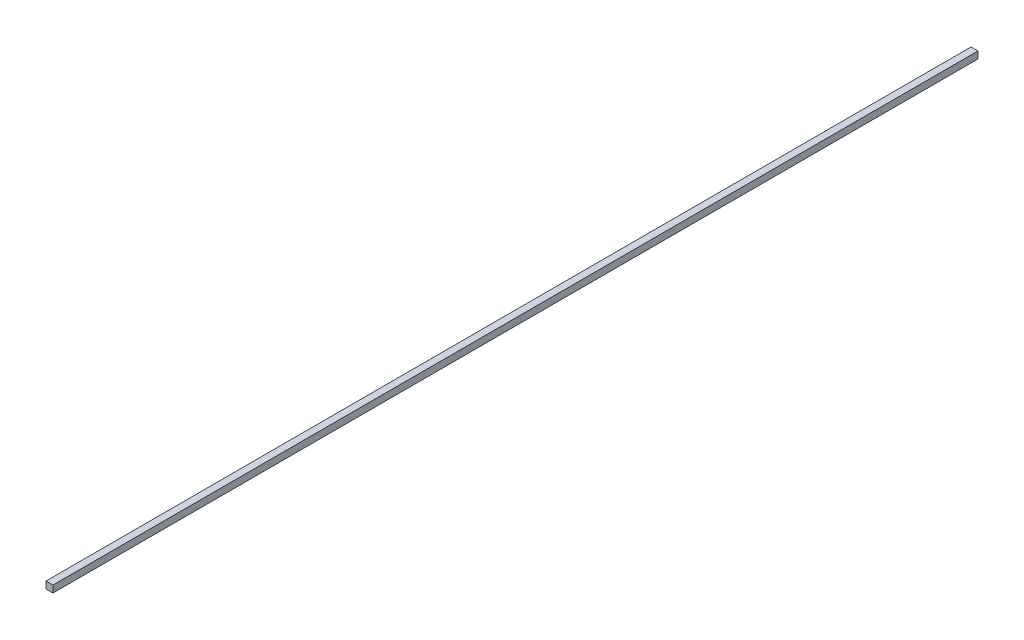
from build123d import *

# Parameters (mm, degrees)
SKETCH1_W           = 15
SKETCH1_H           = 15
BOSS_EXTRUDE1_DEPTH = 2000


with BuildPart() as part:
    # Sketch1 → Boss-Extrude1 (new body)
    with BuildSketch(Plane.XY):
        Rectangle(SKETCH1_W, SKETCH1_H)
    extrude(amount=BOSS_EXTRUDE1_DEPTH)


solid = part.part
